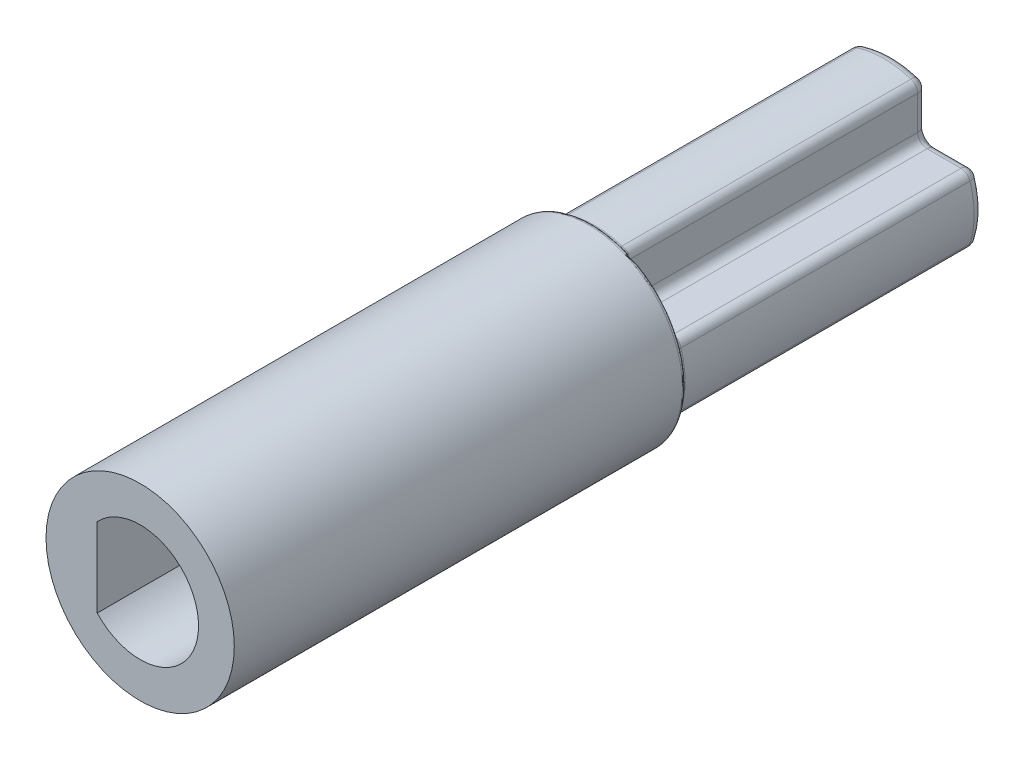
from build123d import *

# Parameters (mm, degrees)
SKETCH2_R           = 2.5
BOSS_EXTRUDE1_DEPTH = 10
BOSS_EXTRUDE2_START = 2
SKETCH3_R           = 2.5
BOSS_EXTRUDE2_DEPTH = 2
BOSS_EXTRUDE3_DEPTH = 8
FILLET1_R           = 0.25
FILLET2_R           = 0.1
FILLET3_R           = 0.1
SKETCH5_R           = 1
CUT_EXTRUDE1_DEPTH  = 21.310096036


with BuildPart() as part:
    # Sketch2 → Boss-Extrude1 (new body)
    with BuildSketch(Plane.XY):
        Circle(SKETCH2_R)
        with BuildLine():
            Line((-1.140175425, 1.05), (-1.140175425, -1.05))
            ThreePointArc((-1.140175425, -1.05), (1.55, 0), (-1.140175425, 1.05))
        make_face(mode=Mode.SUBTRACT)
    extrude(amount=BOSS_EXTRUDE1_DEPTH)

    # Sketch3 → Boss-Extrude2 (add)
    with BuildSketch(Plane(origin=(0, 0, 0), x_dir=(-1, 0, 0), z_dir=(0, 0, -1)).offset(BOSS_EXTRUDE2_START)):
        Circle(SKETCH3_R)
    extrude(amount=-BOSS_EXTRUDE2_DEPTH)

    # Sketch4 → Boss-Extrude3 (add)
    with BuildSketch(Plane(origin=(0, 0, -2), x_dir=(-1, 0, 0), z_dir=(0, 0, -1))):
        with BuildLine():
            Line((-2.045727255, 0.895), (-1.145, 0.895))
            ThreePointArc((-1.145, 0.895), (-0.968223305, 0.968223305), (-0.895, 1.145))
            Line((-0.895, 1.145), (-0.895, 2.045727255))
            ThreePointArc((-0.895, 2.045727255), (-0.846610647, 2.193555354), (-0.720174825, 2.284157004))
            ThreePointArc((-0.720174825, 2.284157004), (0, 2.395), (0.720174825, 2.284157004))
            ThreePointArc((0.720174825, 2.284157004), (0.846610647, 2.193555354), (0.895, 2.045727255))
            Line((0.895, 2.045727255), (0.895, 1.145))
            ThreePointArc((0.895, 1.145), (0.968223305, 0.968223305), (1.145, 0.895))
            Line((1.145, 0.895), (2.045727255, 0.895))
            ThreePointArc((2.045727255, 0.895), (2.193555354, 0.846610647), (2.284157004, 0.720174825))
            ThreePointArc((2.284157004, 0.720174825), (2.395, 0), (2.284157004, -0.720174825))
            ThreePointArc((2.284157004, -0.720174825), (2.193555354, -0.846610647), (2.045727255, -0.895))
            Line((2.045727255, -0.895), (1.145, -0.895))
            ThreePointArc((1.145, -0.895), (0.968223305, -0.968223305), (0.895, -1.145))
            Line((0.895, -1.145), (0.895, -2.045727255))
            ThreePointArc((0.895, -2.045727255), (0.846610647, -2.193555354), (0.720174825, -2.284157004))
            ThreePointArc((0.720174825, -2.284157004), (0, -2.395), (-0.720174825, -2.284157004))
            ThreePointArc((-0.720174825, -2.284157004), (-0.846610647, -2.193555354), (-0.895, -2.045727255))
            Line((-0.895, -2.045727255), (-0.895, -1.145))
            ThreePointArc((-0.895, -1.145), (-0.968223305, -0.968223305), (-1.145, -0.895))
            Line((-1.145, -0.895), (-2.045727255, -0.895))
            ThreePointArc((-2.045727255, -0.895), (-2.193555354, -0.846610647), (-2.284157004, -0.720174825))
            ThreePointArc((-2.284157004, -0.720174825), (-2.395, 0), (-2.284157004, 0.720174825))
            ThreePointArc((-2.284157004, 0.720174825), (-2.193555354, 0.846610647), (-2.045727255, 0.895))
        make_face()
    extrude(amount=BOSS_EXTRUDE3_DEPTH)

    # Fillet1
    fillet1_edges = [part.edges().sort_by_distance(p)[0] for p in [
        (0.895, 1.595363627, -10),
        (1.595363627, 0.895, -10),
        (2.193555354, 0.846610647, -10),
        (1.595363627, -0.895, -10),
        (0.895, -1.595363627, -10),
        (-0.895, -1.595363627, -10),
        (-1.595363627, -0.895, -10),
        (-1.595363627, 0.895, -10),
        (-0.895, 1.595363627, -10),
        (0.968223305, 0.968223305, -10),
        (2.395, 0, -10),
        (2.193555354, -0.846610647, -10),
        (0.968223305, -0.968223305, -10),
        (0.846610647, -2.193555354, -10),
        (0, -2.395, -10),
        (-0.846610647, -2.193555354, -10),
        (-0.968223305, -0.968223305, -10),
        (-2.193555354, -0.846610647, -10),
        (-2.395, 0, -10),
        (-2.193555354, 0.846610647, -10),
        (-0.968223305, 0.968223305, -10),
        (-0.846610647, 2.193555354, -10),
        (0, 2.395, -10),
        (0.846610647, 2.193555354, -10),
    ]]
    fillet(fillet1_edges, radius=FILLET1_R)

    # Fillet2
    fillet2_edges = [part.edges().sort_by_distance(p)[0] for p in [
        (2.5, 0, -2),
    ]]
    fillet(fillet2_edges, radius=FILLET2_R)

    # Fillet3
    fillet3_edges = [part.edges().sort_by_distance(p)[0] for p in [
        (0.968223305, 0.968223305, -2),
        (2.395, 0, -2),
        (2.193555354, -0.846610647, -2),
        (0.968223305, -0.968223305, -2),
        (0.846610647, -2.193555354, -2),
        (0, -2.395, -2),
        (-0.846610647, -2.193555354, -2),
        (-0.968223305, -0.968223305, -2),
        (-2.193555354, -0.846610647, -2),
        (-2.395, 0, -2),
        (-2.193555354, 0.846610647, -2),
        (-0.968223305, 0.968223305, -2),
        (-0.846610647, 2.193555354, -2),
        (0, 2.395, -2),
        (0.846610647, 2.193555354, -2),
        (0.895, 1.595363627, -2),
        (-0.895, 1.595363627, -2),
        (-1.595363627, 0.895, -2),
        (-1.595363627, -0.895, -2),
        (-0.895, -1.595363627, -2),
        (0.895, -1.595363627, -2),
        (1.595363627, -0.895, -2),
        (2.193555354, 0.846610647, -2),
        (1.595363627, 0.895, -2),
    ]]
    fillet(fillet3_edges, radius=FILLET3_R)

    # Sketch5 → Cut-Extrude1 (cut, through all)
    with BuildSketch(Plane(origin=(0, 0, -10), x_dir=(-1, 0, 0), z_dir=(0, 0, -1))):
        Circle(SKETCH5_R)
    extrude(amount=-CUT_EXTRUDE1_DEPTH, mode=Mode.SUBTRACT)


solid = part.part
